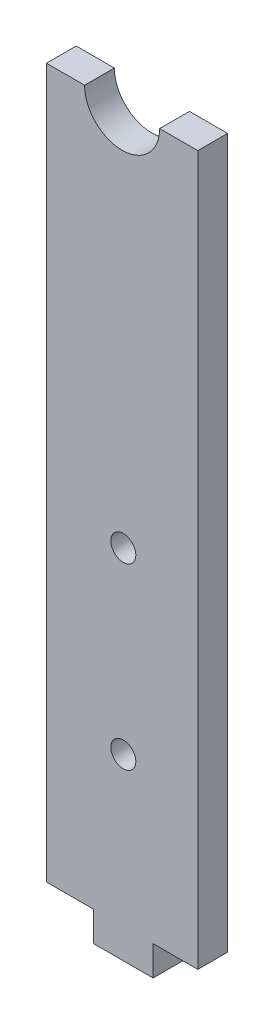
from build123d import *

# Parameters (mm, degrees)
SKETCH1_W           = 25.4
SKETCH1_H           = 124
BOSS_EXTRUDE1_DEPTH = 5
SKETCH2_R           = 2.1
CUT_EXTRUDE1_DEPTH  = 35
SKETCH5_W           = 7.5
SKETCH5_H           = 5
SKETCH5_W_2         = 7.9
CUT_EXTRUDE3_DEPTH  = 10
CUT_EXTRUDE4_DEPTH  = 10


with BuildPart() as part:
    # Sketch1 → Boss-Extrude1 (new body)
    with BuildSketch(Plane.XY):
        with Locations((-24.991212543, -48.06789091)):
            Rectangle(SKETCH1_W, SKETCH1_H)
    extrude(amount=BOSS_EXTRUDE1_DEPTH)

    # Sketch2 → Cut-Extrude1 (cut)
    with BuildSketch(Plane.XY.offset(5)):
        with Locations((-24.791212543, -50.06789091)):
            Circle(SKETCH2_R)
        with Locations((-24.791212543, -80.06789091)):
            Circle(SKETCH2_R)
    extrude(amount=-CUT_EXTRUDE1_DEPTH, mode=Mode.SUBTRACT)

    # Sketch5 → Cut-Extrude3 (cut)
    with BuildSketch(Plane(origin=(0, 0, 0), x_dir=(-1, 0, 0), z_dir=(0, 0, -1))):
        with Locations((16.041212543, -107.56789091)):
            Rectangle(SKETCH5_W, SKETCH5_H)
        with Locations((33.741212543, -107.56789091)):
            Rectangle(SKETCH5_W_2, SKETCH5_H)
    extrude(amount=-CUT_EXTRUDE3_DEPTH, mode=Mode.SUBTRACT)

    # Sketch7 → Cut-Extrude4 (cut)
    with BuildSketch(Plane(origin=(0, 0, 0), x_dir=(-1, 0, 0), z_dir=(0, 0, -1))):
        with BuildLine():
            Line((18.691212543, 13.93210909), (31.291212543, 13.93210909))
            ThreePointArc((31.291212543, 13.93210909), (24.991212543, 7.63210909), (18.691212543, 13.93210909))
        make_face()
    extrude(amount=-CUT_EXTRUDE4_DEPTH, mode=Mode.SUBTRACT)


solid = part.part
